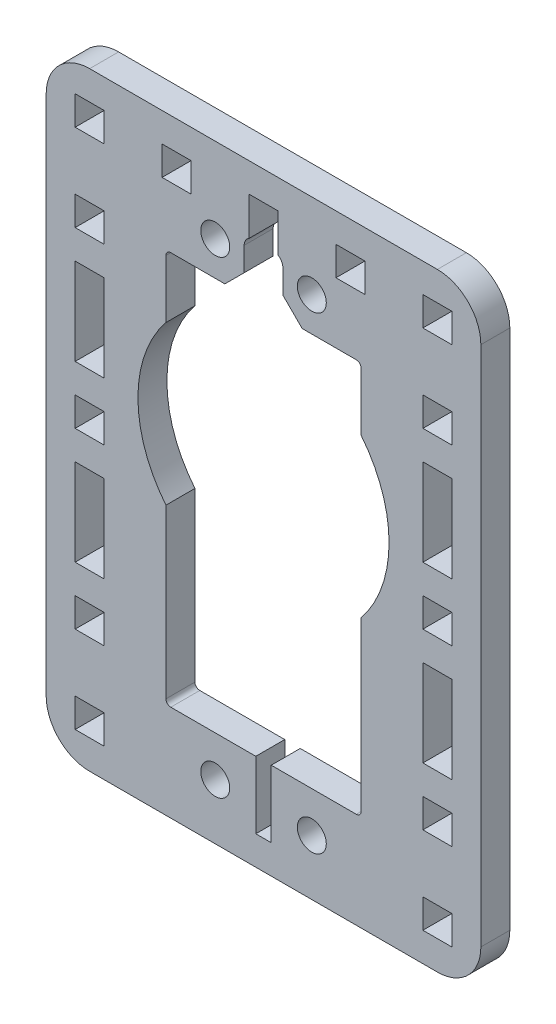
from build123d import *

# Parameters (mm, degrees)
MODEL_W                 = 3
MODEL_H                 = 3
MODEL_R                 = 1.5
MODEL_H_2               = 9
SALIENTE_EXTRUIR1_DEPTH = 3


with BuildPart() as part:
    # Model → Saliente-Extruir1 (new body)
    with BuildSketch(Plane.XY):
        with BuildLine():
            Line((7.279746634, 294.056370254), (7.279746634, 240.056370254))
            ThreePointArc((7.279746634, 240.056370254), (8.597766118, 236.874389738), (11.779746634, 235.556370254))
            Line((11.779746634, 235.556370254), (47.779746634, 235.556370254))
            ThreePointArc((47.779746634, 235.556370254), (50.961727149, 236.874389738), (52.279746634, 240.056370254))
            Line((52.279746634, 240.056370254), (52.279746634, 294.056370254))
            ThreePointArc((52.279746634, 294.056370254), (50.961727149, 297.238350769), (47.779746634, 298.556370254))
            Line((47.779746634, 298.556370254), (11.779746634, 298.556370254))
            ThreePointArc((11.779746634, 298.556370254), (8.597766118, 297.238350769), (7.279746634, 294.056370254))
        make_face()
        with Locations((11.779746634, 240.056370254)):
            Rectangle(MODEL_W, MODEL_H, mode=Mode.SUBTRACT)
        with Locations((11.779746634, 249.056370254)):
            Rectangle(MODEL_W, MODEL_H, mode=Mode.SUBTRACT)
        with Locations((24.779746634, 241.306370254)):
            Circle(MODEL_R, mode=Mode.SUBTRACT)
        with Locations((11.779746634, 258.056370254)):
            Rectangle(MODEL_W, MODEL_H_2, mode=Mode.SUBTRACT)
        with Locations((34.779746634, 241.306370254)):
            Circle(MODEL_R, mode=Mode.SUBTRACT)
        with Locations((47.779746634, 240.056370254)):
            Rectangle(MODEL_W, MODEL_H, mode=Mode.SUBTRACT)
        with Locations((47.779746634, 249.056370254)):
            Rectangle(MODEL_W, MODEL_H, mode=Mode.SUBTRACT)
        with Locations((47.779746634, 258.056370254)):
            Rectangle(MODEL_W, MODEL_H_2, mode=Mode.SUBTRACT)
        with Locations((11.779746634, 267.056370254)):
            Rectangle(MODEL_W, MODEL_H, mode=Mode.SUBTRACT)
        with Locations((11.779746634, 276.056370254)):
            Rectangle(MODEL_W, MODEL_H_2, mode=Mode.SUBTRACT)
        with BuildLine():
            Line((28.279746634, 291.586497273), (28.279746634, 295.556370254))
            Line((28.279746634, 295.556370254), (31.279746634, 295.556370254))
            Line((31.279746634, 295.556370254), (31.279746634, 291.586497273))
            ThreePointArc((31.279746634, 291.586497273), (31.645772038, 291.220471869), (31.779746634, 290.720471869))
            Line((31.779746634, 290.720471869), (31.779746634, 288.256370254))
            Line((31.779746634, 288.256370254), (33.779746634, 286.256370254))
            Line((33.779746634, 286.256370254), (39.379746634, 286.256370254))
            ThreePointArc((39.379746634, 286.256370254), (39.733300024, 286.109923644), (39.879746634, 285.756370254))
            Line((39.879746634, 285.756370254), (39.879746634, 279.739428783))
            ThreePointArc((39.879746634, 279.739428783), (42.778382711, 271.556370254), (39.879746634, 263.373311725))
            Line((39.879746634, 263.373311725), (39.879746634, 246.006370254))
            ThreePointArc((39.879746634, 246.006370254), (39.733300024, 245.652816863), (39.379746634, 245.506370254))
            Line((39.379746634, 245.506370254), (30.579746634, 245.506370254))
            Line((30.579746634, 245.506370254), (30.579746634, 238.556370254))
            Line((30.579746634, 238.556370254), (28.979746634, 238.556370254))
            Line((28.979746634, 238.556370254), (28.979746634, 245.506370254))
            Line((28.979746634, 245.506370254), (20.179746634, 245.506370254))
            ThreePointArc((20.179746634, 245.506370254), (19.826193243, 245.652816863), (19.679746634, 246.006370254))
            Line((19.679746634, 246.006370254), (19.679746634, 263.369945552))
            ThreePointArc((19.679746634, 263.369945552), (16.778382711, 271.556370254), (19.679746634, 279.742794955))
            Line((19.679746634, 279.742794955), (19.679746634, 285.756370254))
            ThreePointArc((19.679746634, 285.756370254), (19.826193243, 286.109923644), (20.179746634, 286.256370254))
            Line((20.179746634, 286.256370254), (25.779746634, 286.256370254))
            Line((25.779746634, 286.256370254), (27.779746634, 288.256370254))
            Line((27.779746634, 288.256370254), (27.779746634, 290.720471869))
            ThreePointArc((27.779746634, 290.720471869), (27.91372123, 291.220471869), (28.279746634, 291.586497273))
        make_face(mode=Mode.SUBTRACT)
        with Locations((11.779746634, 285.056370254)):
            Rectangle(MODEL_W, MODEL_H, mode=Mode.SUBTRACT)
        with Locations((11.779746634, 294.056370254)):
            Rectangle(MODEL_W, MODEL_H, mode=Mode.SUBTRACT)
        with Locations((24.779746634, 289.806370254)):
            Circle(MODEL_R, mode=Mode.SUBTRACT)
        with Locations((20.779746634, 294.056370254)):
            Rectangle(MODEL_W, MODEL_H, mode=Mode.SUBTRACT)
        with Locations((47.779746634, 267.056370254)):
            Rectangle(MODEL_W, MODEL_H, mode=Mode.SUBTRACT)
        with Locations((47.779746634, 276.056370254)):
            Rectangle(MODEL_W, MODEL_H_2, mode=Mode.SUBTRACT)
        with Locations((34.779746634, 289.806370254)):
            Circle(MODEL_R, mode=Mode.SUBTRACT)
        with Locations((38.779746634, 294.056370254)):
            Rectangle(MODEL_W, MODEL_H, mode=Mode.SUBTRACT)
        with Locations((47.779746634, 285.056370254)):
            Rectangle(MODEL_W, MODEL_H, mode=Mode.SUBTRACT)
        with Locations((47.779746634, 294.056370254)):
            Rectangle(MODEL_W, MODEL_H, mode=Mode.SUBTRACT)
    extrude(amount=SALIENTE_EXTRUIR1_DEPTH)


solid = part.part
